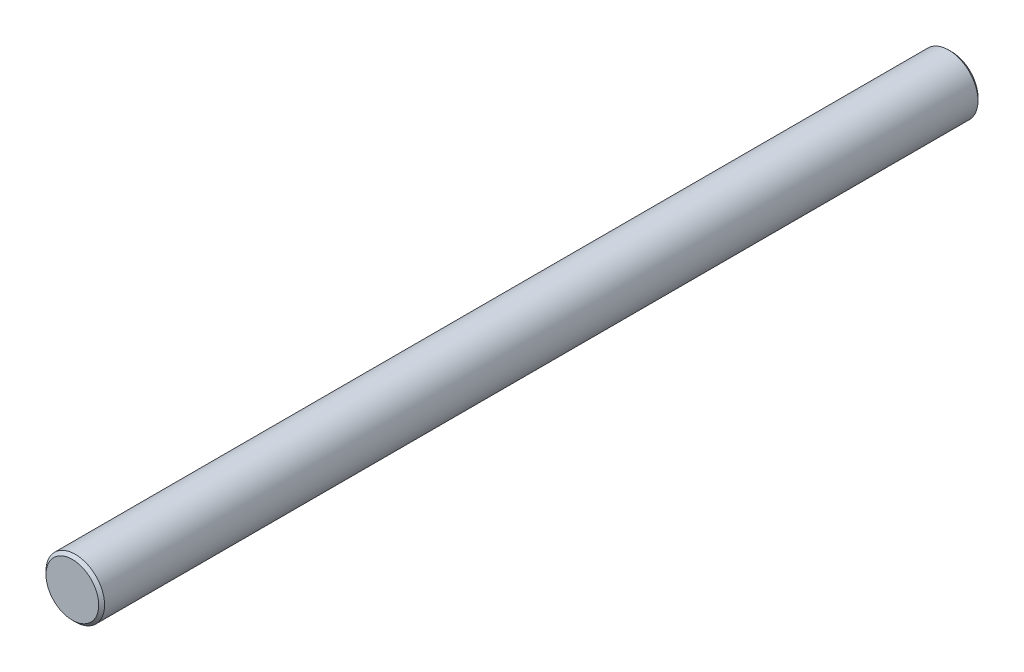
from build123d import *

# Parameters (mm, degrees)
SKETCH_1_R      = 2
EXTRUDE_1_DEPTH = 60
CHAMFER_1_SIZE  = 0.2


with BuildPart() as part:
    # 草图1 → 凸台-拉伸1 (new body)
    with BuildSketch(Plane.XY):
        Circle(SKETCH_1_R)
    extrude(amount=EXTRUDE_1_DEPTH)

    # 倒角1
    chamfer_1_edges = [part.edges().sort_by_distance(p)[0] for p in [
        (-2, 0, 0),
        (-2, 0, 60),
    ]]
    chamfer(chamfer_1_edges, length=CHAMFER_1_SIZE)


solid = part.part
